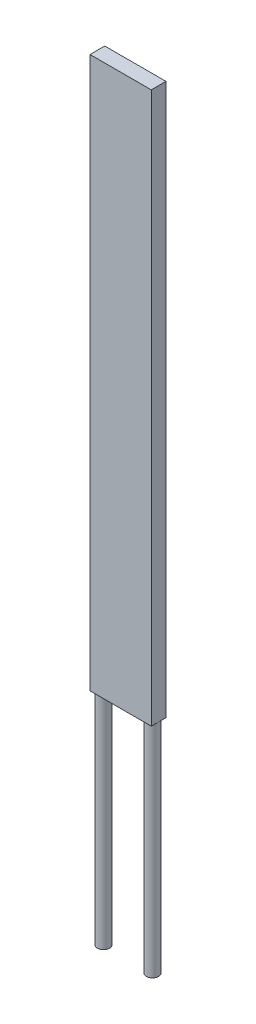
from build123d import *

# Parameters (mm, degrees)
SWEEP1_PROFILE_R    = 3.175
SWEEP2_PROFILE_R    = 3.175
SKETCH42_W          = 31.75
SKETCH42_H          = 285.7
BOSS_EXTRUDE1_DEPTH = 3.81


with BuildPart() as part:
    # Sweep1: sweep along a path in Sketch1
    with BuildLine(Plane.XY) as sweep1_path:
        Line((0, 0), (0, 114.3))
    # Sweep1 profile (on start of the path) → Sweep1 (sweep)
    with BuildSketch(Plane.ZX):
        Circle(SWEEP1_PROFILE_R)
    sweep(path=sweep1_path.line)



with BuildPart() as body_2:
    # Sweep2: sweep along a path in Sketch1<3>
    with BuildLine(Plane.XY) as sweep2_path:
        Line((25.4, 114.3), (25.4, 0))
    # Sweep2 profile (on start of the path) → Sweep2 (sweep)
    with BuildSketch(Plane(origin=(25.4, 114.3, 0), x_dir=(-1, 0, 0), z_dir=(0, -1, 0))):
        Circle(SWEEP2_PROFILE_R)
    sweep(path=sweep2_path.line)


with BuildPart() as part_1:
    add(part.part)

    add(body_2.part)  # Boss-Extrude1 merges body 2
    # Sketch42 → Boss-Extrude1 (add, symmetric)
    with BuildSketch(Plane.XY):
        with Locations((12.7, 257.15)):
            Rectangle(SKETCH42_W, SKETCH42_H)
    extrude(amount=BOSS_EXTRUDE1_DEPTH, both=True)


solid = part_1.part
